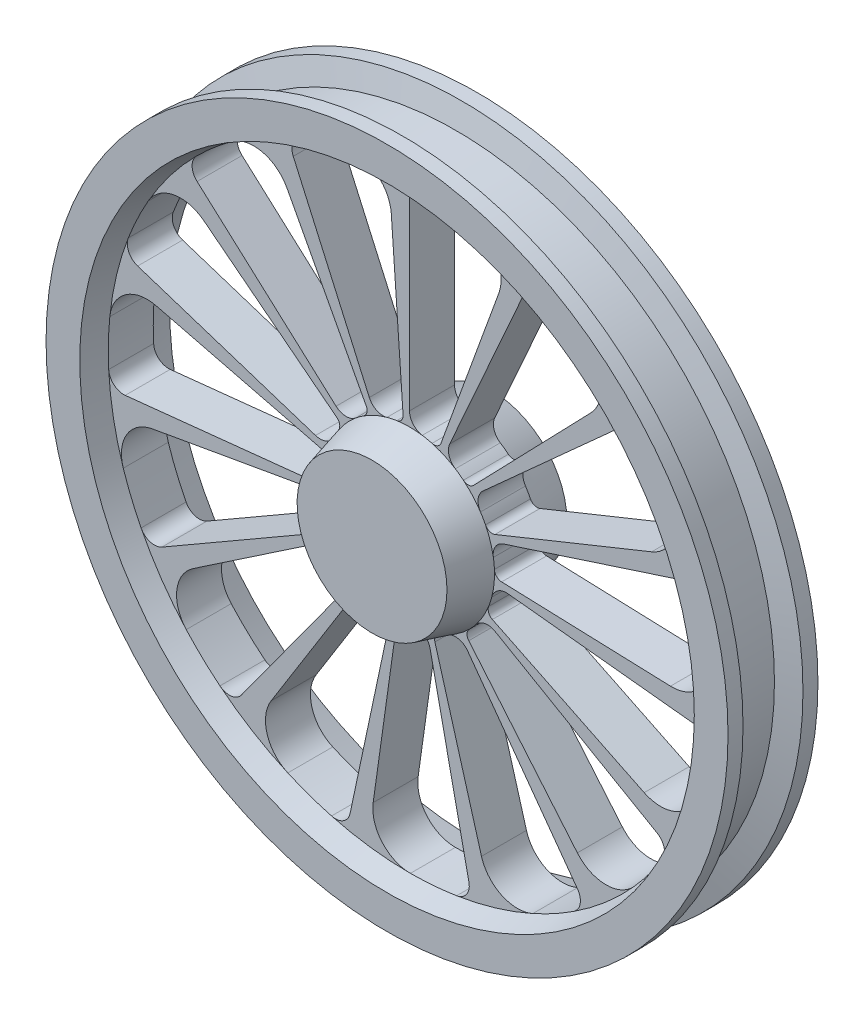
from build123d import *

# Parameters (mm, degrees)
CUT_EXTRUDE1_DEPTH = 653.80165441


with BuildPart() as part:
    # Sketch1 → Revolve1 (revolve)
    with BuildSketch(Plane(origin=(0, 0, 0), x_dir=(0, 0, -1), z_dir=(1, 0, 0)), mode=Mode.PRIVATE) as revolve1_sk:
        Polygon((-80, 0), (80, 0), (80, 100), (30, 113.397459622), (30, 401.961524227), (60, 410), (60, 455), (40, 455), (31.961524227, 425), (-31.961524227, 425), (-40, 455), (-60, 455), (-60, 410), (-30, 401.961524227), (-30, 113.397459622), (-80, 100), align=None)
    revolve(revolve1_sk.sketch.rotate(Axis((0, 0, 1000), (0, 0, -1)), 90), axis=Axis((0, 0, 1000), (0, 0, -1)))

    # Sketch2 → Cut-Extrude1 (cut, through all)
    with BuildSketch(Plane.XY.offset(30)):
        with BuildLine():
            Line((0, 131.889659312), (0, 381.437551887))
            ThreePointArc((0, 381.437551887), (6.23309254, 395.945213966), (21.047225897, 401.410116017))
            ThreePointArc((21.047225897, 401.410116017), (51.890290127, 398.598124368), (82.425300135, 393.419797235))
            ThreePointArc((82.425300135, 393.419797235), (115.868001581, 368.786536674), (119.15704686, 327.381295617))
            Line((119.15704686, 327.381295617), (42.065603785, 115.574296534))
            ThreePointArc((42.065603785, 115.574296534), (37.258917189, 110.110259097), (30.021242396, 109.351309336))
            ThreePointArc((30.021242396, 109.351309336), (23.551936394, 110.924704826), (17.001442148, 112.115720635))
            ThreePointArc((17.001442148, 112.115720635), (4.834724581, 118.850701475), (0, 131.889659312))
        make_face()
        with BuildLine():
            Line((242.01334809, 250.612158289), (85.437142658, 88.472751146))
            ThreePointArc((85.437142658, 88.472751146), (78.823591708, 85.436160136), (71.902954099, 87.686652578))
            ThreePointArc((71.902954099, 87.686652578), (66.632906586, 91.755324687), (61.133162095, 95.50769781))
            ThreePointArc((61.133162095, 95.50769781), (52.757676025, 106.609058824), (53.644357285, 120.487199175))
            Line((53.644357285, 120.487199175), (155.144629398, 348.460542901))
            ThreePointArc((155.144629398, 348.460542901), (166.739640547, 359.178724558), (182.4958007, 358.145710132))
            ThreePointArc((182.4958007, 358.145710132), (209.528601883, 343.031823527), (235.31750618, 325.881478829))
            ThreePointArc((235.31750618, 325.881478829), (255.849684469, 289.775503416), (242.01334809, 250.612158289))
        make_face()
        with BuildLine():
            Line((323.023342813, 130.509902053), (114.035823395, 46.073463336))
            ThreePointArc((114.035823395, 46.073463336), (106.758951131, 45.989372924), (101.351991821, 50.860176981))
            ThreePointArc((101.351991821, 50.860176981), (98.192441889, 56.720615339), (94.694402938, 62.385526373))
            ThreePointArc((94.694402938, 62.385526373), (91.558345996, 75.933741389), (98.013117852, 88.251407708))
            Line((98.013117852, 88.251407708), (283.463342928, 255.231540382))
            ThreePointArc((283.463342928, 255.231540382), (298.415389922, 260.306970638), (312.389193639, 252.954657313))
            ThreePointArc((312.389193639, 252.954657313), (330.937514866, 228.152204051), (347.521177614, 201.995292194))
            ThreePointArc((347.521177614, 201.995292194), (351.592632591, 160.659653088), (323.023342813, 130.509902053))
        make_face()
        with BuildLine():
            Line((348.179666989, -12.158701893), (122.916674283, -4.292344849))
            ThreePointArc((122.916674283, -4.292344849), (116.234718028, -1.409394667), (113.276349403, 5.239514734))
            ThreePointArc((113.276349403, 5.239514734), (112.773611939, 11.878396309), (111.882121242, 18.476330672))
            ThreePointArc((111.882121242, 18.476330672), (114.527746163, 32.128790232), (125.434519921, 40.75614611))
            Line((125.434519921, 40.75614611), (362.768669282, 117.870685826))
            ThreePointArc((362.768669282, 117.870685826), (378.49240736, 116.42577668), (388.267657032, 104.025446224))
            ThreePointArc((388.267657032, 104.025446224), (395.124325055, 73.822995798), (399.635280308, 43.182284468))
            ThreePointArc((399.635280308, 43.182284468), (386.542020419, 3.764289195), (348.179666989, -12.158701893))
        make_face()
        with BuildLine():
            Line((313.132563629, -152.724955823), (110.544115525, -53.915967616))
            ThreePointArc((110.544115525, -53.915967616), (105.61244622, -48.564465115), (105.614197089, -41.287107211))
            ThreePointArc((105.614197089, -41.287107211), (107.855199968, -35.017705356), (109.724404365, -28.627590455))
            ThreePointArc((109.724404365, -28.627590455), (117.694258566, -17.231520638), (131.167153959, -13.786223409))
            Line((131.167153959, -13.786223409), (379.347997068, -39.871081131))
            ThreePointArc((379.347997068, -39.871081131), (393.12464907, -47.58649176), (397.011115222, -62.890709559))
            ThreePointArc((397.011115222, -62.890709559), (390.990549851, -93.27087909), (382.648812464, -123.097332541))
            ThreePointArc((382.648812464, -123.097332541), (354.654781293, -153.781954498), (313.132563629, -152.724955823))
        make_face()
        with BuildLine():
            Line((223.941995298, -266.883677429), (79.057474931, -94.21702977))
            ThreePointArc((79.057474931, -94.21702977), (76.728823001, -87.322298352), (79.690390624, -80.674813237))
            ThreePointArc((79.690390624, -80.674813237), (84.28764409, -75.858927638), (88.59434116, -70.781541119))
            ThreePointArc((88.59434116, -70.781541119), (100.510364444, -63.612345045), (114.219795461, -65.944829656))
            Line((114.219795461, -65.944829656), (330.334609892, -190.718775944))
            ThreePointArc((330.334609892, -190.718775944), (339.782067531, -203.370623466), (337.107744858, -218.932490315))
            ThreePointArc((337.107744858, -218.932490315), (319.25095654, -244.237371644), (299.49888869, -268.092302449))
            ThreePointArc((299.49888869, -268.092302449), (261.444508543, -284.737901192), (223.941995298, -266.883677429))
        make_face()
        with BuildLine():
            Line((96.029821531, -334.895786646), (33.901078706, -118.227111542))
            ThreePointArc((33.901078706, -118.227111542), (34.578089225, -110.981312904), (39.987391656, -106.113111146))
            ThreePointArc((39.987391656, -106.113111146), (46.145988819, -103.583452175), (52.145511513, -100.696720293))
            ThreePointArc((52.145511513, -100.696720293), (65.947315202, -98.994017095), (77.522796674, -106.700975766))
            Line((77.522796674, -106.700975766), (224.20336767, -308.58946177))
            ThreePointArc((224.20336767, -308.58946177), (227.688079693, -323.990126811), (218.91538288, -337.118854556))
            ThreePointArc((218.91538288, -337.118854556), (192.309972539, -352.973003813), (164.562886199, -366.731677722))
            ThreePointArc((164.562886199, -366.731677722), (123.028105118, -366.460078008), (96.029821531, -334.895786646))
        make_face()
        with BuildLine():
            Line((-48.486780783, -345.001371918), (-17.117122008, -121.794651669))
            ThreePointArc((-17.117122008, -121.794651669), (-13.551510309, -115.450650223), (-6.629790604, -113.203488132))
            ThreePointArc((-6.629790604, -113.203488132), (0.025272858, -113.397456805), (6.680249198, -113.200521727))
            ThreePointArc((6.680249198, -113.200521727), (19.981376049, -117.258724256), (27.421402069, -129.007553818))
            Line((27.421402069, -129.007553818), (79.305326354, -373.102226208))
            ThreePointArc((79.305326354, -373.102226208), (76.224754394, -388.588793871), (62.870562419, -397.014306216))
            ThreePointArc((62.870562419, -397.014306216), (32.116847205, -400.676396965), (1.172465677, -401.959814264))
            ThreePointArc((1.172465677, -401.959814264), (-36.660975358, -384.817978151), (-48.486780783, -345.001371918))
        make_face()
        with BuildLine():
            Line((-184.619578211, -295.453085747), (-65.175616823, -104.302790053))
            ThreePointArc((-65.175616823, -104.302790053), (-59.337930599, -99.957521281), (-52.100621838, -100.719953597))
            ThreePointArc((-52.100621838, -100.719953597), (-46.09981301, -103.60401097), (-39.94008889, -106.13092456))
            ThreePointArc((-39.94008889, -106.13092456), (-29.439524548, -115.248332731), (-27.421402069, -129.007553818))
            Line((-27.421402069, -129.007553818), (-79.305326354, -373.102226208))
            ThreePointArc((-79.305326354, -373.102226208), (-88.41852342, -385.996928254), (-104.045149446, -388.262377569))
            ThreePointArc((-104.045149446, -388.262377569), (-133.629572783, -379.09920105), (-162.420684811, -367.685447229))
            ThreePointArc((-162.420684811, -367.685447229), (-190.011040139, -336.637353911), (-184.619578211, -295.453085747))
        make_face()
        with BuildLine():
            Line((-288.829973349, -194.818276943), (-101.964655387, -68.776028475))
            ThreePointArc((-101.964655387, -68.776028475), (-94.864283621, -67.180828824), (-88.562782238, -70.821024074))
            ThreePointArc((-88.562782238, -70.821024074), (-84.253822405, -75.896490425), (-79.654422766, -80.710326368))
            ThreePointArc((-79.654422766, -80.710326368), (-73.770063901, -93.310457479), (-77.522796674, -106.700975766))
            Line((-77.522796674, -106.700975766), (-224.20336767, -308.58946177))
            ThreePointArc((-224.20336767, -308.58946177), (-237.773435277, -316.662687069), (-252.970509751, -312.376356588))
            ThreePointArc((-252.970509751, -312.376356588), (-276.270225651, -291.972309266), (-297.929823351, -269.834926051))
            ThreePointArc((-297.929823351, -269.834926051), (-310.506469885, -230.249072924), (-288.829973349, -194.818276943))
        make_face()
        with BuildLine():
            Line((-343.099042158, -60.497618188), (-121.123078715, -21.357266764))
            ThreePointArc((-121.123078715, -21.357266764), (-113.98774019, -22.787960745), (-109.711633021, -28.6764961))
            ThreePointArc((-109.711633021, -28.6764961), (-107.839580483, -35.065777188), (-105.595783307, -41.334179516))
            ThreePointArc((-105.595783307, -41.334179516), (-105.345089026, -55.23835643), (-114.219795461, -65.944829656))
            Line((-114.219795461, -65.944829656), (-330.334609892, -190.718775944))
            ThreePointArc((-330.334609892, -190.718775944), (-346.015160071, -192.574590499), (-358.154970756, -182.477625702))
            ThreePointArc((-358.154970756, -182.477625702), (-371.141246667, -154.360752724), (-381.924188825, -125.327494786))
            ThreePointArc((-381.924188825, -125.327494786), (-377.312510124, -84.048635482), (-343.099042158, -60.497618188))
        make_face()
        with BuildLine():
            Line((-338.043169621, 84.283628356), (-119.338221365, 29.754360396))
            ThreePointArc((-119.338221365, 29.754360396), (-113.401680933, 25.545152769), (-111.890345755, 18.426458568))
            ThreePointArc((-111.890345755, 18.426458568), (-112.778895405, 11.828127488), (-113.278673608, 5.189022483))
            ThreePointArc((-113.278673608, 5.189022483), (-118.704991228, -7.615041729), (-131.167153959, -13.786223409))
            Line((-131.167153959, -13.786223409), (-379.347997068, -39.871081131))
            ThreePointArc((-379.347997068, -39.871081131), (-394.42772024, -35.188597748), (-401.411183581, -21.026855576))
            ThreePointArc((-401.411183581, -21.026855576), (-401.838574422, 9.941180287), (-399.880392379, 40.850198893))
            ThreePointArc((-399.880392379, 40.850198893), (-378.877789587, 76.684574593), (-338.043169621, 84.283628356))
        make_face()
        with BuildLine():
            Line((-274.53656203, 214.491469865), (-96.918701387, 75.721188333))
            ThreePointArc((-96.918701387, 75.721188333), (-93.207440822, 69.461277299), (-94.722201217, 62.34331115))
            ThreePointArc((-94.722201217, 62.34331115), (-98.217714747, 56.676841466), (-101.374652136, 50.814995354))
            ThreePointArc((-101.374652136, 50.814995354), (-111.539722045, 41.324982867), (-125.434519921, 40.75614611))
            Line((-125.434519921, 40.75614611), (-362.768669282, 117.870685826))
            ThreePointArc((-362.768669282, 117.870685826), (-374.640144316, 128.281823233), (-375.259756058, 144.059648903))
            ThreePointArc((-375.259756058, 144.059648903), (-363.054362071, 172.524192913), (-348.693643292, 199.96452207))
            ThreePointArc((-348.693643292, 199.96452207), (-314.931657233, 224.158325063), (-274.53656203, 214.491469865))
        make_face()
        with BuildLine():
            Line((-163.560088778, 307.61178764), (-57.74105746, 108.595134902))
            ThreePointArc((-57.74105746, 108.595134902), (-56.896787429, 101.366915948), (-61.175727564, 95.480438864))
            ThreePointArc((-61.175727564, 95.480438864), (-66.673798929, 91.725614661), (-71.942032351, 87.654593889))
            ThreePointArc((-71.942032351, 87.654593889), (-85.088221615, 83.119542499), (-98.013117852, 88.251407708))
            Line((-98.013117852, 88.251407708), (-283.463342928, 255.231540383))
            ThreePointArc((-283.463342928, 255.231540383), (-290.073883941, 269.571151573), (-284.222507585, 284.236931346))
            ThreePointArc((-284.222507585, 284.236931346), (-261.494752272, 305.276205252), (-237.214595497, 324.503162762))
            ThreePointArc((-237.214595497, 324.503162762), (-196.530980279, 332.873064716), (-163.560088778, 307.61178764))
        make_face()
        with BuildLine():
            Line((-24.30259028, 347.543232767), (-8.579460138, 122.691996091))
            ThreePointArc((-8.579460138, 122.691996091), (-10.748162599, 115.74529394), (-17.051414851, 112.108131285))
            ThreePointArc((-17.051414851, 112.108131285), (-23.601377564, 110.914195781), (-30.0699816, 109.337916823))
            ThreePointArc((-30.0699816, 109.337916823), (-43.924194665, 110.541978117), (-53.644357285, 120.487199175))
            Line((-53.644357285, 120.487199175), (-155.144629398, 348.460542901))
            ThreePointArc((-155.144629398, 348.460542901), (-155.351213794, 364.249178829), (-144.040605471, 375.267066147))
            ThreePointArc((-144.040605471, 375.267066147), (-114.7203242, 385.243188355), (-84.718989114, 392.932258592))
            ThreePointArc((-84.718989114, 392.932258592), (-44.148311408, 384.031027422), (-24.30259028, 347.543232767))
        make_face()
    extrude(amount=-CUT_EXTRUDE1_DEPTH, mode=Mode.SUBTRACT)


solid = part.part
